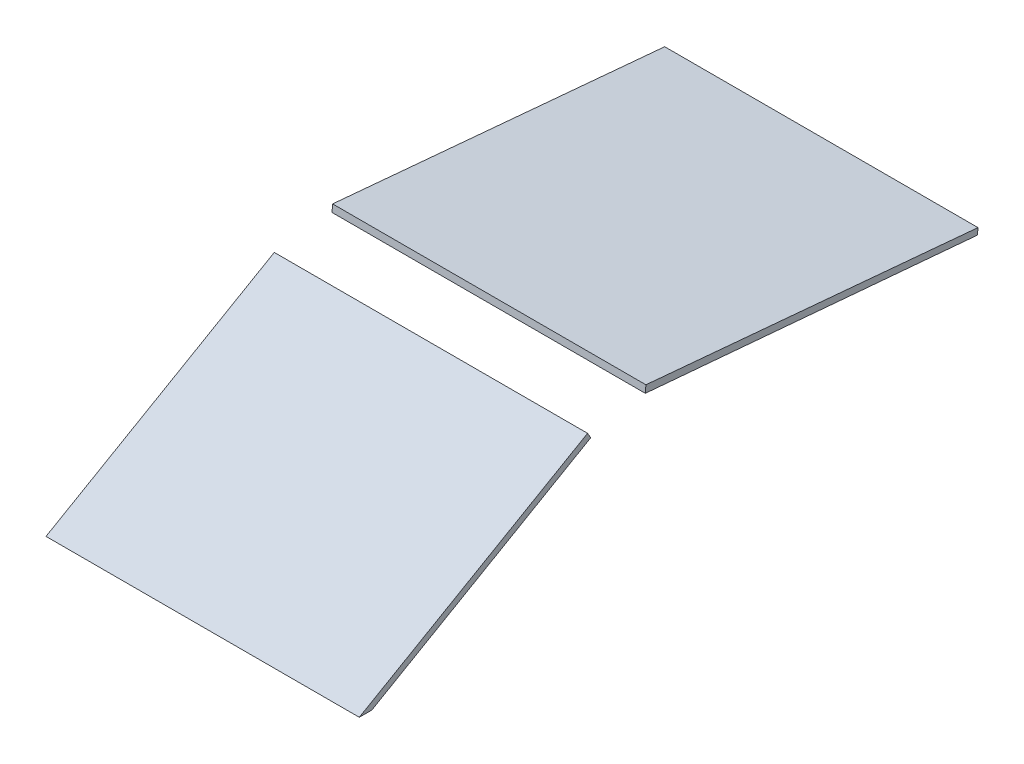
from build123d import *

# Parameters (mm, degrees)
BOSS_EXTRUDE1_DEPTH = 150
CUT_EXTRUDE1_DEPTH  = 335.241226584


with BuildPart() as part:
    # Sketch1 → Boss-Extrude1 (new body)
    with BuildSketch(Plane(origin=(0, 0, 0), x_dir=(0, 0, -1), z_dir=(1, 0, 0))):
        Polygon((0, 0), (116.28989122, 67.14), (289.966474885, 51.945267809), (290.227942114, 54.933851904), (116.28989122, 70.604101615), (-6, 0), align=None)
    extrude(amount=BOSS_EXTRUDE1_DEPTH)

    # Sketch4 → Cut-Extrude1 (cut, through all)
    with BuildSketch(Plane(origin=(150, 0, 0), x_dir=(0, 0, -1), z_dir=(1, 0, 0))):
        Polygon((103.299510163, 63.104101615), (104.799510163, 60.506025404), (116.28989122, 67.14), (130.931994417, 65.85898196), (131.229386395, 69.258187833), (116.28989122, 70.604101615), align=None)
    extrude(amount=-CUT_EXTRUDE1_DEPTH, mode=Mode.SUBTRACT)


with BuildPart() as cut_extrude1_piece_1:
    # of the separate pieces the step leaves, piece 1, a body of its own (cut_extrude1_pieces)
    add(part.part.solids().sort_by_distance((0, 65.85898196, -130.931994417))[0])


with BuildPart() as cut_extrude1_piece_2:
    # of the separate pieces the step leaves, piece 2, a body of its own (cut_extrude1_pieces)
    add(part.part.solids().sort_by_distance((0, 0, 0))[0])


solid = Compound([cut_extrude1_piece_1.part, cut_extrude1_piece_2.part])
